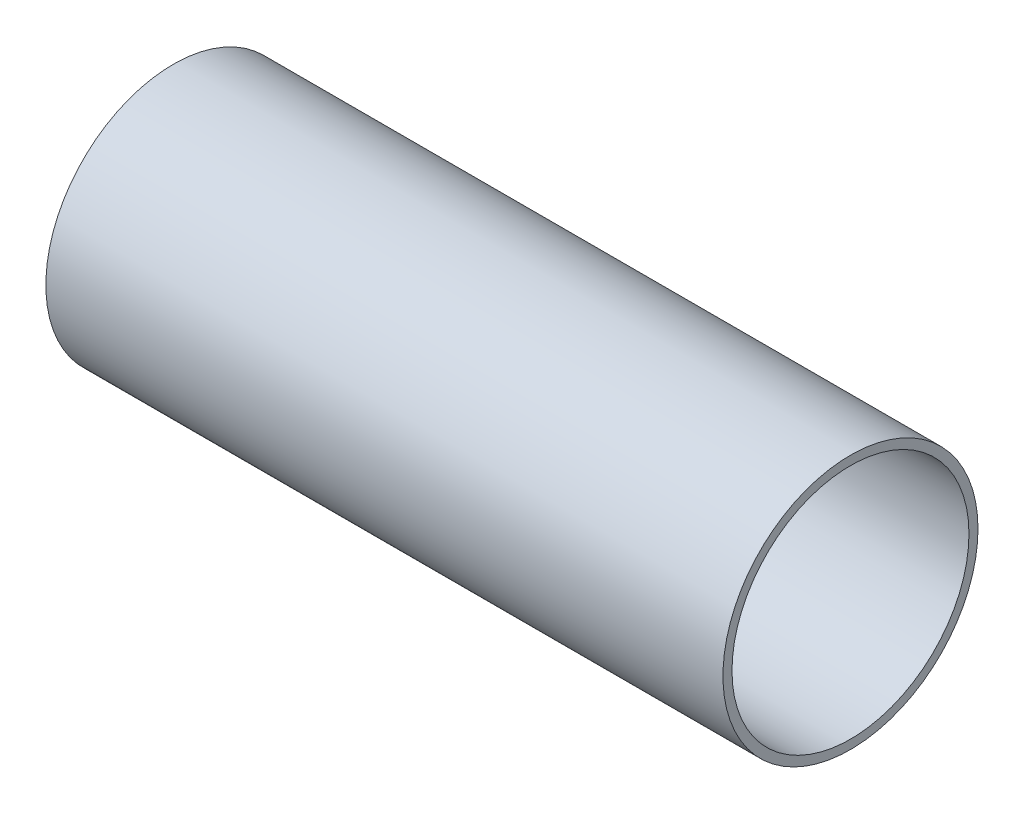
from build123d import *

# Parameters (mm, degrees)
SKETCH1_R           = 56.5
SKETCH1_R_2         = 52.5
BOSS_EXTRUDE1_DEPTH = 300


with BuildPart() as part:
    # Sketch1 → Boss-Extrude1 (new body)
    with BuildSketch(Plane(origin=(0, 0, 0), x_dir=(0, 0, -1), z_dir=(1, 0, 0))):
        Circle(SKETCH1_R)
        Circle(SKETCH1_R_2, mode=Mode.SUBTRACT)
    extrude(amount=BOSS_EXTRUDE1_DEPTH)


solid = part.part
